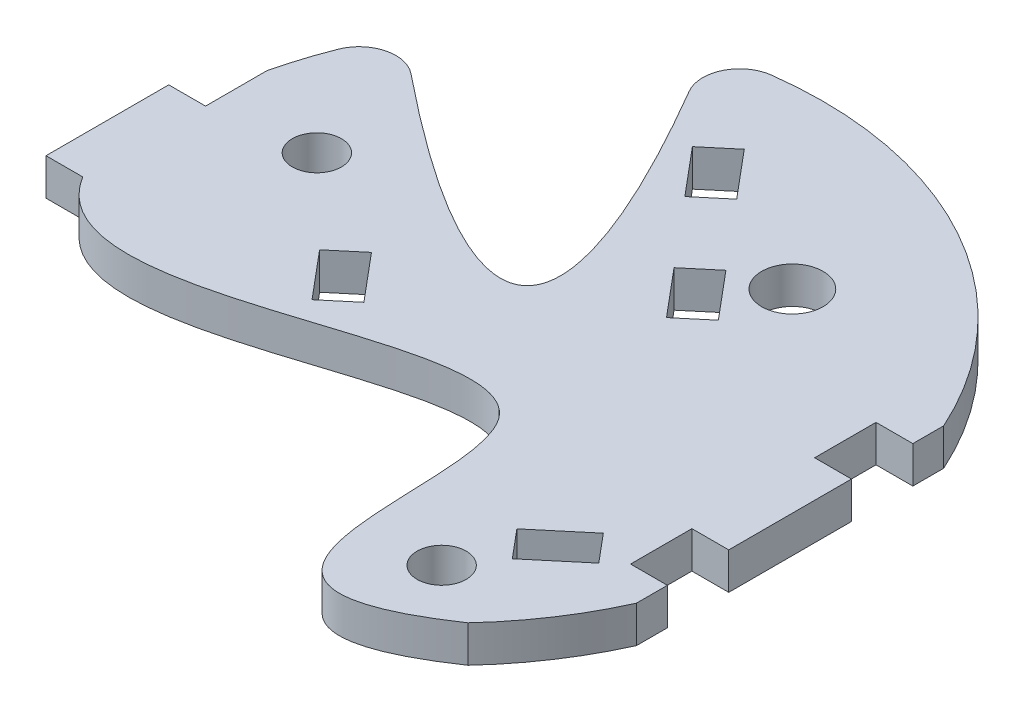
from build123d import *

# Parameters (mm, degrees)
CROQUIS1_R                 = 30.5
SALIENTE_EXTRUIR1_DEPTH    = 3
CORTAR_EXTRUIR3_START      = -4
CORTAR_EXTRUIR3_DEPTH      = 4
CORTAR_EXTRUIR6_START      = -10
CROQUIS9_R                 = 2
CORTAR_EXTRUIR6_DEPTH      = 10
REDONDEO1_R                = 3
CROQUIS10_R                = 2.5
CORTAR_EXTRUIR7_DEPTH      = 10
CORTAR_EXTRUIR8_DEPTH      = 44.237715166
CORTAR_EXTRUIR8_DEPTH_BACK = 44.237715166


with BuildPart() as part:
    # Croquis1 → Saliente-Extruir1 (new body)
    with BuildSketch(Plane(origin=(0, 0, 0), x_dir=(1, 0, 0), z_dir=(0, 1, 0))):
        with Locations(Location((0, 0, 0), (0, 0, 270))):
            Circle(CROQUIS1_R)
    extrude(amount=SALIENTE_EXTRUIR1_DEPTH)

    # Croquis5 → Cortar-Extruir3 (cut)
    with BuildSketch(Plane(origin=(0, 3, 0), x_dir=(1, 0, 0), z_dir=(0, 1, 0)).offset(CORTAR_EXTRUIR3_START)):
        with BuildLine():
            Line((28.814059068, 5), (30.087372767, 5))
            ThreePointArc((30.087372767, 5), (29.556634924, 7.526973624), (28.814059068, 10))
            Line((28.814059068, 10), (24.814059068, 10))
            Line((24.814059068, 10), (24.814059068, 5))
            Line((24.814059068, 5), (28.814059068, 5))
        make_face()
        with BuildLine():
            Line((30.087372767, -5), (28.814059068, -5))
            Line((28.814059068, -5), (24.814059068, -5))
            Line((24.814059068, -5), (24.814059068, -10))
            Line((24.814059068, -10), (28.814059068, -10))
            ThreePointArc((28.814059068, -10), (29.556634924, -7.526973624), (30.087372767, -5))
        make_face()
        with BuildLine():
            Line((-24.814059068, 5), (-24.814059068, 10))
            Line((-24.814059068, 10), (-28.814059068, 10))
            ThreePointArc((-28.814059068, 10), (-29.556634924, 7.526973624), (-30.087372767, 5))
            Line((-30.087372767, 5), (-28.814059068, 5))
            Line((-28.814059068, 5), (-24.814059068, 5))
        make_face()
        with BuildLine():
            Line((-28.814059068, -10), (-24.814059068, -10))
            Line((-24.814059068, -10), (-24.814059068, -5))
            Line((-24.814059068, -5), (-28.814059068, -5))
            Line((-28.814059068, -5), (-30.087372767, -5))
            ThreePointArc((-30.087372767, -5), (-29.556634924, -7.526973624), (-28.814059068, -10))
        make_face()
    extrude(amount=CORTAR_EXTRUIR3_DEPTH, mode=Mode.SUBTRACT)

    # Croquis9 → Cortar-Extruir6 (cut)
    with BuildSketch(Plane(origin=(0, 3, 0), x_dir=(1, 0, 0), z_dir=(0, 1, 0)).offset(CORTAR_EXTRUIR6_START)):
        Polygon((5.673284852, 12.685390231), (8.887222901, 8.855168016), (11.18535623, 10.783530845), (7.971418181, 14.613753061), align=None)
        with BuildLine():
            add(Edge.make_bspline(
                [(22.328940845, -20.776631121), (5.973751648, -31.851207958), (22.176782581, 15.835204965), (-18.206868011, -15.807645224), (-24.814059068, -5)],
                knots=[0, 0, 0, 0, 0.445790092, 1, 1, 1, 1], degree=3))
            Line((-24.814059068, -5), (-24.814059068, -10))
            Line((-24.814059068, -10), (-28.814059068, -10))
            ThreePointArc((-28.814059068, -10), (-6.288730728, -29.84462876), (22.328940845, -20.776631121))
        make_face()
        with BuildLine():
            add(Edge.make_bspline(
                [(-18.745320889, 15.664553597), (3.867000935, -2.576496257), (8.094246487, 2.496379136), (-8.307345659, 29.346856869)],
                knots=[0.040527546, 0.040527546, 0.040527546, 0.040527546, 1, 1, 1, 1], degree=3))
            ThreePointArc((-8.307345659, 29.346856869), (-20.930238649, 22.185019948), (-28.814059068, 10))
            Line((-28.814059068, 10), (-24.814059068, 10))
            add(Edge.make_bspline(
                [(-24.814059068, 10), (-24.456478323, 11.504954743), (-23.99064654, 12.985671633), (-23.418905183, 14.432273611)],
                knots=[0.635079884, 0.635079884, 0.635079884, 0.635079884, 0.831813486, 0.831813486, 0.831813486, 0.831813486], degree=3))
            ThreePointArc((-23.418905183, 14.432273611), (-21.393777069, 16.230440533), (-18.745320889, 15.664553597))
        make_face()
        Polygon((-2.120514915, 21.973679104), (1.093423133, 18.143456889), (3.391556462, 20.071819718), (0.177618414, 23.902041933), align=None)
        Polygon((-4.518554854, -2.393615154), (-7.732492903, 1.436607062), (-10.030626232, -0.491755767), (-6.816688183, -4.321977983), align=None)
        Polygon((23.455638465, -11.229310268), (21.527275636, -8.931176939), (17.69705342, -12.145114987), (19.625416249, -14.443248317), align=None)
        with Locations(Location((-16.983501418, 6.238634388, 0), (0, 0, 270))):
            Circle(CROQUIS9_R)
        with Locations(Location((17.204026086, -17.780443199, 0), (0, 0, 270))):
            Circle(CROQUIS9_R)
    extrude(amount=CORTAR_EXTRUIR6_DEPTH, mode=Mode.SUBTRACT)

    # Redondeo1
    redondeo1_edges = [part.edges().sort_by_distance(p)[0] for p in [
        (-8.307345659, 1.5, -29.346856869),
    ]]
    fillet(redondeo1_edges, radius=REDONDEO1_R)

    # Croquis10 → Cortar-Extruir7 (cut)
    with BuildSketch(Plane(origin=(0, 3, 0), x_dir=(1, 0, 0), z_dir=(0, 1, 0))):
        with Locations(Location((12, 16, 0), (0, 0, 270))):
            Circle(CROQUIS10_R)
    extrude(amount=-CORTAR_EXTRUIR7_DEPTH, mode=Mode.SUBTRACT)

    # Croquis11 → Cortar-Extruir8 (cut, two sides: drawn at the far end of the back side and taken through both)
    with BuildSketch(Plane(origin=(0, 3, 0), x_dir=(1, 0, 0), z_dir=(0, 1, 0)).offset(-CORTAR_EXTRUIR8_DEPTH_BACK)):
        with BuildLine():
            Line((30.087372767, 5), (27.814059068, 5))
            Line((27.814059068, 5), (27.814059068, -5))
            Line((27.814059068, -5), (30.087372767, -5))
            ThreePointArc((30.087372767, -5), (30.5, 0), (30.087372767, 5))
        make_face()
        with BuildLine():
            Line((28.814059068, -10), (27.814059068, -10))
            Line((27.814059068, -10), (27.814059068, -12.515115586))
            ThreePointArc((27.814059068, -12.515115586), (28.341972277, -11.268655974), (28.814059068, -10))
        make_face()
        with BuildLine():
            Line((27.814059068, 12.515115586), (27.814059068, 10))
            Line((27.814059068, 10), (28.814059068, 10))
            ThreePointArc((28.814059068, 10), (28.341972277, 11.268655974), (27.814059068, 12.515115586))
        make_face()
        with BuildLine():
            Line((-27.814059068, -5), (-27.814059068, 5))
            Line((-27.814059068, 5), (-30.087372767, 5))
            ThreePointArc((-30.087372767, 5), (-30.5, 0), (-30.087372767, -5))
            Line((-30.087372767, -5), (-27.814059068, -5))
        make_face()
    extrude(amount=CORTAR_EXTRUIR8_DEPTH + CORTAR_EXTRUIR8_DEPTH_BACK, mode=Mode.SUBTRACT)


solid = part.part
